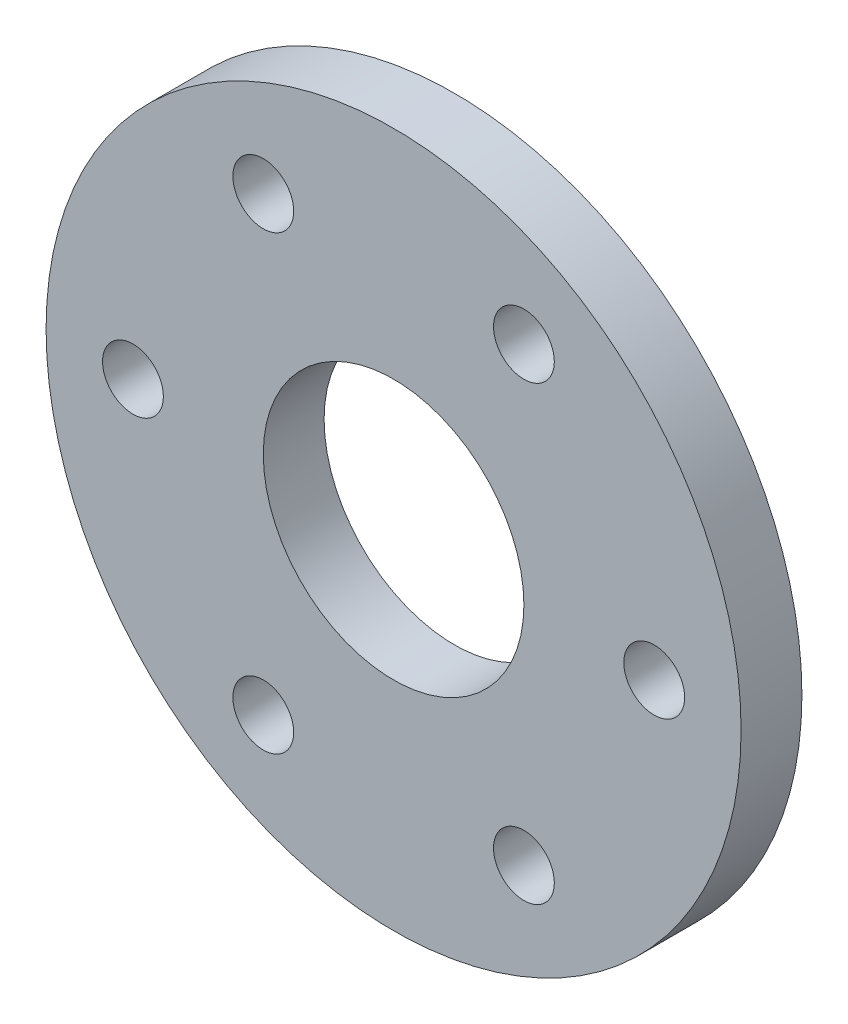
from build123d import *

# Parameters (mm, degrees)
SKETCH_1_R      = 80
SKETCH_1_R_2    = 30
SKETCH_1_R_3    = 7
EXTRUDE_1_DEPTH = 14


with BuildPart() as part:
    # 草图1 → 凸台-拉伸1 (new body)
    with BuildSketch(Plane.XY):
        Circle(SKETCH_1_R)
        Circle(SKETCH_1_R_2, mode=Mode.SUBTRACT)
        with Locations((60, 0)):
            Circle(SKETCH_1_R_3, mode=Mode.SUBTRACT)
        with Locations((30, 51.961524227)):
            Circle(SKETCH_1_R_3, mode=Mode.SUBTRACT)
        with Locations((-30, 51.961524227)):
            Circle(SKETCH_1_R_3, mode=Mode.SUBTRACT)
        with Locations((-60, 0)):
            Circle(SKETCH_1_R_3, mode=Mode.SUBTRACT)
        with Locations((-30, -51.961524227)):
            Circle(SKETCH_1_R_3, mode=Mode.SUBTRACT)
        with Locations((30, -51.961524227)):
            Circle(SKETCH_1_R_3, mode=Mode.SUBTRACT)
    extrude(amount=EXTRUDE_1_DEPTH)


solid = part.part
